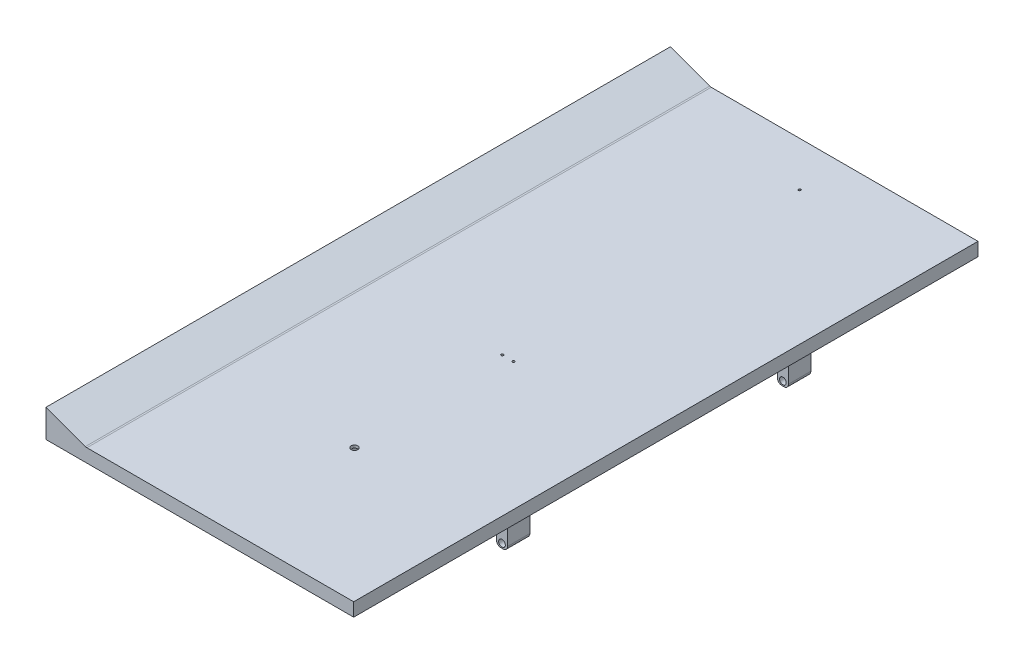
from build123d import *

# Parameters (mm, degrees)
BOSS_EXTRUDE1_DEPTH      = 1040
BOSS_EXTRUDE1_DEPTH_BACK = 360
SKETCH2_R                = 7.5
BOSS_EXTRUDE2_DEPTH      = 680
SKETCH4_W                = 580
SKETCH4_H                = 10
CUT_EXTRUDE1_DEPTH       = 1252.319303775
CUT_EXTRUDE2_DEPTH       = 1252.319303775
CUT_EXTRUDE2_DEPTH_BACK  = 1252.319303775
SKETCH5_W                = 580
SKETCH5_H                = 50
CUT_EXTRUDE3_DEPTH       = 1252.319303775
CUT_EXTRUDE3_DEPTH_BACK  = 1252.319303775
SKETCH6_R                = 7.5
SKETCH8_W                = 25
SKETCH8_H                = 32
BOSS_EXTRUDE4_DEPTH      = 37.5
SKETCH9_W                = 16.002
SKETCH9_H                = 32.5
CUT_EXTRUDE4_DEPTH       = 66.8
SKETCH11_W               = 16.002
SKETCH11_H               = 64
CUT_EXTRUDE5_DEPTH       = 24
SKETCH13_R               = 2.5908
CUT_EXTRUDE6_DEPTH       = 20


with BuildPart() as part:
    # Sketch1 → Boss-Extrude1 (new, two sides: drawn at the far end of the back side and taken through both)
    with BuildSketch(Plane.XY.offset(-BOSS_EXTRUDE1_DEPTH_BACK)):
        with BuildLine():
            Line((0, 0), (-598.236730193, 0))
            ThreePointArc((-598.236730193, 0), (-599.97321197, 0.15192247), (-601.656931626, 0.603073792))
            Line((-601.656931626, 0.603073792), (-690, 32.757321084))
            Line((-690, 32.757321084), (-690, -30))
            Line((-690, -30), (-656.445665216, -30))
            Line((-656.445665216, -30), (-26.446144718, -30))
            Line((-26.446144718, -30), (0, -30))
            Line((0, -30), (0, -20.000479502))
            Line((0, -20.000479502), (0, 0))
        make_face()
    extrude(amount=BOSS_EXTRUDE1_DEPTH + BOSS_EXTRUDE1_DEPTH_BACK)

    # Sketch2 → Boss-Extrude2 (add)
    # profile 1 of 2: a face of its own
    with BuildSketch(Plane.XY):
        with BuildLine():
            Line((-690, -30), (-690, -80))
            ThreePointArc((-690, -80), (-687.071067812, -87.071067812), (-680, -90))
            Line((-680, -90), (-350, -90))
            ThreePointArc((-350, -90), (-342.928932188, -87.071067812), (-340, -80))
            Line((-340, -80), (-340, -30))
            Line((-340, -30), (-690, -30))
        make_face()
        with BuildLine():
            Line((-677.5, -72.5), (-352.5, -72.5))
            ThreePointArc((-352.5, -72.5), (-345, -80), (-352.5, -87.5))
            Line((-352.5, -87.5), (-677.5, -87.5))
            ThreePointArc((-677.5, -87.5), (-685, -80), (-677.5, -72.5))
        make_face(mode=Mode.SUBTRACT)
    # profile 2 of 2: a face of its own
    with BuildSketch(Plane.XY):
        with BuildLine():
            Line((-15, -30), (-15, -80))
            ThreePointArc((-15, -80), (-17.928932188, -87.071067812), (-25, -90))
            Line((-25, -90), (-30, -90))
            ThreePointArc((-30, -90), (-37.071067812, -87.071067812), (-40, -80))
            Line((-40, -80), (-40, -30))
            Line((-40, -30), (-15, -30))
        make_face()
        with Locations((-27.5, -80)):
            Circle(SKETCH2_R, mode=Mode.SUBTRACT)
    extrude(amount=BOSS_EXTRUDE2_DEPTH)

    # Sketch4 → Cut-Extrude1 (cut, through all)
    with BuildSketch(Plane(origin=(0, 0, 0), x_dir=(0, 0, -1), z_dir=(1, 0, 0))):
        with Locations((-340, -85)):
            Rectangle(SKETCH4_W, SKETCH4_H)
    extrude(amount=-CUT_EXTRUDE1_DEPTH, mode=Mode.SUBTRACT)

    # Sketch5 → Cut-Extrude2 (cut, two sides: drawn at the far end of the back side and taken through both)
    with BuildSketch(Plane.ZY.offset(690).offset(-CUT_EXTRUDE2_DEPTH_BACK)):
        with Locations((340, -55)):
            Rectangle(SKETCH5_W, SKETCH5_H)
    extrude(amount=CUT_EXTRUDE2_DEPTH + CUT_EXTRUDE2_DEPTH_BACK, mode=Mode.SUBTRACT)

    # Sketch6 → Cut-Extrude3 (cut, two sides: drawn at the far end of the back side and taken through both)
    with BuildSketch(Plane(origin=(0, 0, 0), x_dir=(1, 0, 0), z_dir=(0, 1, 0)).offset(-CUT_EXTRUDE3_DEPTH_BACK)):
        with Locations((-298.236730193, -740)):
            Circle(SKETCH6_R)
    extrude(amount=CUT_EXTRUDE3_DEPTH + CUT_EXTRUDE3_DEPTH_BACK, mode=Mode.SUBTRACT)

    # Sketch8 → Boss-Extrude4 (add)
    with BuildSketch(Plane.XZ.offset(30)):
        with Locations((-298.236730193, 740)):
            Rectangle(SKETCH8_W, SKETCH8_H)
    extrude(amount=BOSS_EXTRUDE4_DEPTH)

    # Sketch9 → Cut-Extrude4 (cut)
    with BuildSketch(Plane.XY.offset(756)):
        with Locations((-298.237730193, -46.25)):
            Rectangle(SKETCH9_W, SKETCH9_H)
    extrude(amount=-CUT_EXTRUDE4_DEPTH, mode=Mode.SUBTRACT)

    # Sketch11 → Cut-Extrude5 (cut)
    with BuildSketch(Plane.XZ.offset(30)):
        with Locations((-298.237730193, 740)):
            Rectangle(SKETCH11_W, SKETCH11_H)
    extrude(amount=-CUT_EXTRUDE5_DEPTH, mode=Mode.SUBTRACT)

    # Sketch13 → Cut-Extrude6 (cut)
    with BuildSketch(Plane(origin=(0, 0, 0), x_dir=(1, 0, 0), z_dir=(0, 1, 0))):
        with Locations(Location((-300, 260, 0), (0, 0, 180))):
            Circle(SKETCH13_R)
        with Locations(Location((-287.3, -394.05, 0), (0, 0, 180))):
            Circle(SKETCH13_R)
        with Locations(Location((-312.7, -394.05, 0), (0, 0, 180))):
            Circle(SKETCH13_R)
    extrude(amount=-CUT_EXTRUDE6_DEPTH, mode=Mode.SUBTRACT)


solid = part.part
